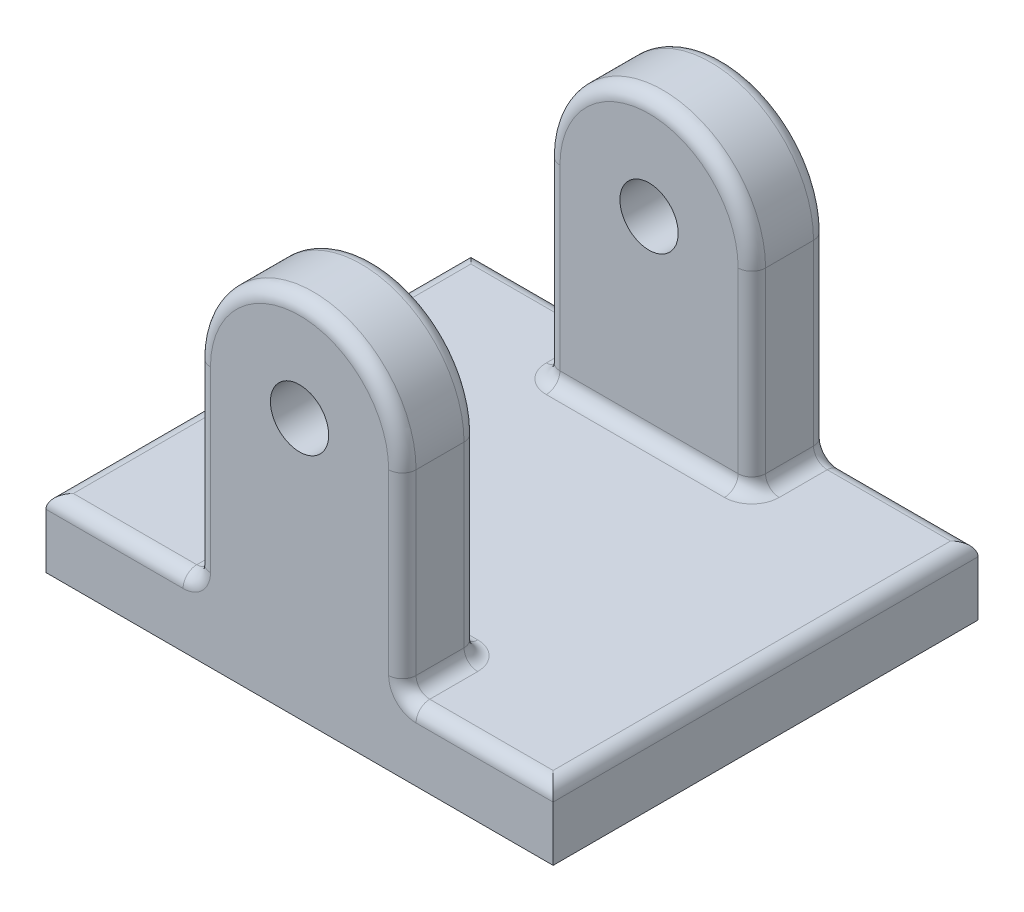
from build123d import *

# Parameters (mm, degrees)
SKETCH2_W           = 74
SKETCH2_H           = 62
BOSS_EXTRUDE1_DEPTH = 10
BOSS_EXTRUDE2_DEPTH = 11
SKETCH5_R           = 4.25
CUT_EXTRUDE2_DEPTH  = 75
FILLET1_R           = 2


with BuildPart() as part:
    # Sketch2 → Boss-Extrude1 (new body)
    with BuildSketch(Plane(origin=(0, 0, 0), x_dir=(1, 0, 0), z_dir=(0, 1, 0))):
        with Locations((37, 31)):
            Rectangle(SKETCH2_W, SKETCH2_H)
    extrude(amount=BOSS_EXTRUDE1_DEPTH)

    # Sketch3 → Boss-Extrude2 (add)
    with BuildSketch(Plane.XY):
        with BuildLine():
            Line((22, 10), (22, 38))
            ThreePointArc((22, 38), (37, 53), (52, 38))
            Line((52, 38), (52, 10))
            Line((52, 10), (22, 10))
        make_face()
    boss_extrude2 = extrude(amount=-BOSS_EXTRUDE2_DEPTH)

    # Mirror1: Boss-Extrude2 across plane
    add(boss_extrude2.mirror(Plane.XY.offset(-31)))

    # Sketch5 → Cut-Extrude2 (cut)
    with BuildSketch(Plane(origin=(0, 0, -62), x_dir=(-1, 0, 0), z_dir=(0, 0, -1))):
        with Locations((-37, 38)):
            Circle(SKETCH5_R)
    extrude(amount=-CUT_EXTRUDE2_DEPTH, mode=Mode.SUBTRACT)

    # Fillet1
    fillet1_edges = [part.edges().sort_by_distance(p)[0] for p in [
        (74, 10, -31),
        (63, 10, -62),
        (63, 10, 0),
        (37, 10, -11),
        (52, 10, -5.5),
        (22, 24, -11),
        (22, 10, -5.5),
        (37, 53, -11),
        (52, 24, -11),
        (52, 24, 0),
        (37, 53, 0),
        (22, 24, 0),
        (11, 10, -62),
        (22, 10, -56.5),
        (52, 24, -62),
        (52, 10, -56.5),
        (37, 53, -62),
        (0, 10, -31),
        (22, 24, -62),
        (37, 10, -51),
        (52, 24, -51),
        (37, 53, -51),
        (22, 24, -51),
        (11, 10, 0),
    ]]
    fillet(fillet1_edges, radius=FILLET1_R)


solid = part.part
